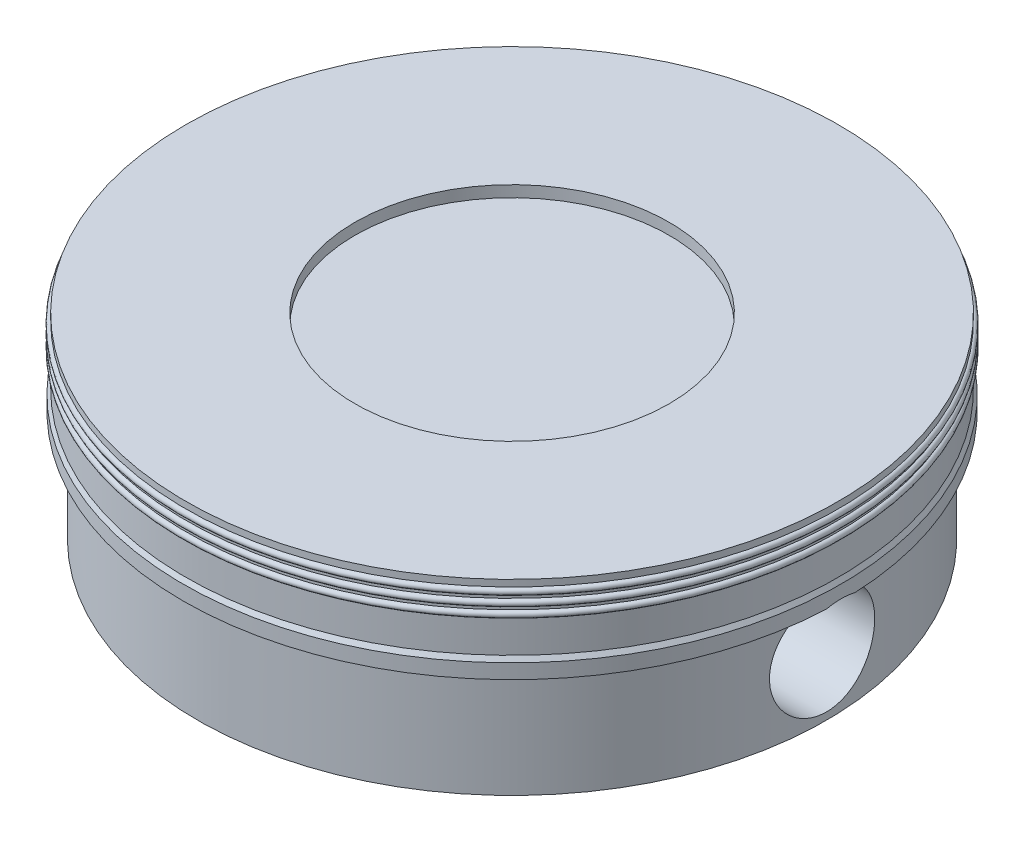
from build123d import *

# Parameters (mm, degrees)
BOSS_EXTRUDE1_DEPTH     = 2.33
BOSS_EXTRUDE1_2_DEPTH   = 2.33
CUT_EXTRUDE1_DEPTH      = 12.212273133
CUT_EXTRUDE1_DEPTH_BACK = 12.212273133
SKETCH4_R               = 0.8


with BuildPart() as part:
    # Sketch2 → Revolve2 (revolve)
    with BuildSketch(Plane.XY, mode=Mode.PRIVATE) as revolve2_sk:
        with BuildLine():
            Line((0.209698236, -2.972), (-1.140301764, -2.972))
            Line((-1.140301764, -2.972), (-1.140301764, -1.042))
            Line((-1.140301764, -1.042), (0, -1.042))
            Line((0, -1.042), (0, -0.642))
            Line((0, -0.642), (-4.570301764, -0.642))
            Line((-4.570301764, -0.642), (-4.570301764, -0.172))
            Line((-4.570301764, -0.172), (-2.180301764, -0.172))
            Line((-2.180301764, -0.172), (-2.180301764, 0))
            Line((-2.180301764, 0), (0.389698236, 0))
            Line((0.389698236, 0), (0.389698236, -0.1))
            ThreePointArc((0.389698236, -0.1), (0.439698236, -0.15), (0.389698236, -0.2))
            Line((0.389698236, -0.2), (0.389698236, -0.25))
            ThreePointArc((0.389698236, -0.25), (0.439698236, -0.3), (0.389698236, -0.35))
            Line((0.389698236, -0.35), (0.389698236, -0.4))
            ThreePointArc((0.389698236, -0.4), (0.439698236, -0.45), (0.389698236, -0.5))
            Line((0.389698236, -0.5), (0.389698236, -1))
            Line((0.389698236, -1), (0.429698236, -1.07))
            Line((0.429698236, -1.07), (0.429698236, -1.292))
            Line((0.429698236, -1.292), (0.209698236, -1.292))
            Line((0.209698236, -1.292), (0.209698236, -2.972))
        make_face()
    revolve(revolve2_sk.sketch.rotate(Axis((-4.570301764, -0.752898092, 0), (0, -1, 0)), 180), axis=Axis((-4.570301764, -0.752898092, 0), (0, -1, 0)))


with BuildPart() as body_2:
    # Sketch3 → Boss-Extrude1 (new body)
    with BuildSketch(Plane.XZ.offset(2.972)):
        with BuildLine():
            Line((-6.070301764, 3.084623154), (-6.070301764, -3.084623154))
            ThreePointArc((-6.070301764, -3.084623154), (-8.000301764, 0), (-6.070301764, 3.084623154))
        make_face()
    extrude(amount=-BOSS_EXTRUDE1_DEPTH)


with BuildPart() as body_3:
    # Sketch3 → Boss-Extrude1 2 (new body)
    with BuildSketch(Plane.XZ.offset(2.972)):
        with BuildLine():
            Line((-3.070301764, 3.084623154), (-3.070301764, -3.084623154))
            ThreePointArc((-3.070301764, -3.084623154), (-1.140301764, 0), (-3.070301764, 3.084623154))
        make_face()
    extrude(amount=-BOSS_EXTRUDE1_2_DEPTH)


with BuildPart() as cut_extrude1_tool:
    # Sketch4 → Cut-Extrude1 (new, two sides: drawn at the far end of the back side and taken through both)
    with BuildSketch(Plane(origin=(0, 0, 0), x_dir=(0, 0, -1), z_dir=(1, 0, 0)).offset(-CUT_EXTRUDE1_DEPTH_BACK)):
        with Locations((0, -2.062)):
            Circle(SKETCH4_R)
    extrude(amount=CUT_EXTRUDE1_DEPTH + CUT_EXTRUDE1_DEPTH_BACK)


with BuildPart() as part_1:
    add(part.part)

    # Cut-Extrude1: cut by cut_extrude1_tool
    add(cut_extrude1_tool.part, mode=Mode.SUBTRACT)


with BuildPart() as body_2_1:
    add(body_2.part)

    # Cut-Extrude1: cut by cut_extrude1_tool
    add(cut_extrude1_tool.part, mode=Mode.SUBTRACT)


with BuildPart() as body_3_1:
    add(body_3.part)

    # Cut-Extrude1: cut by cut_extrude1_tool
    add(cut_extrude1_tool.part, mode=Mode.SUBTRACT)


solid = Compound([part_1.part, body_2_1.part, body_3_1.part])
